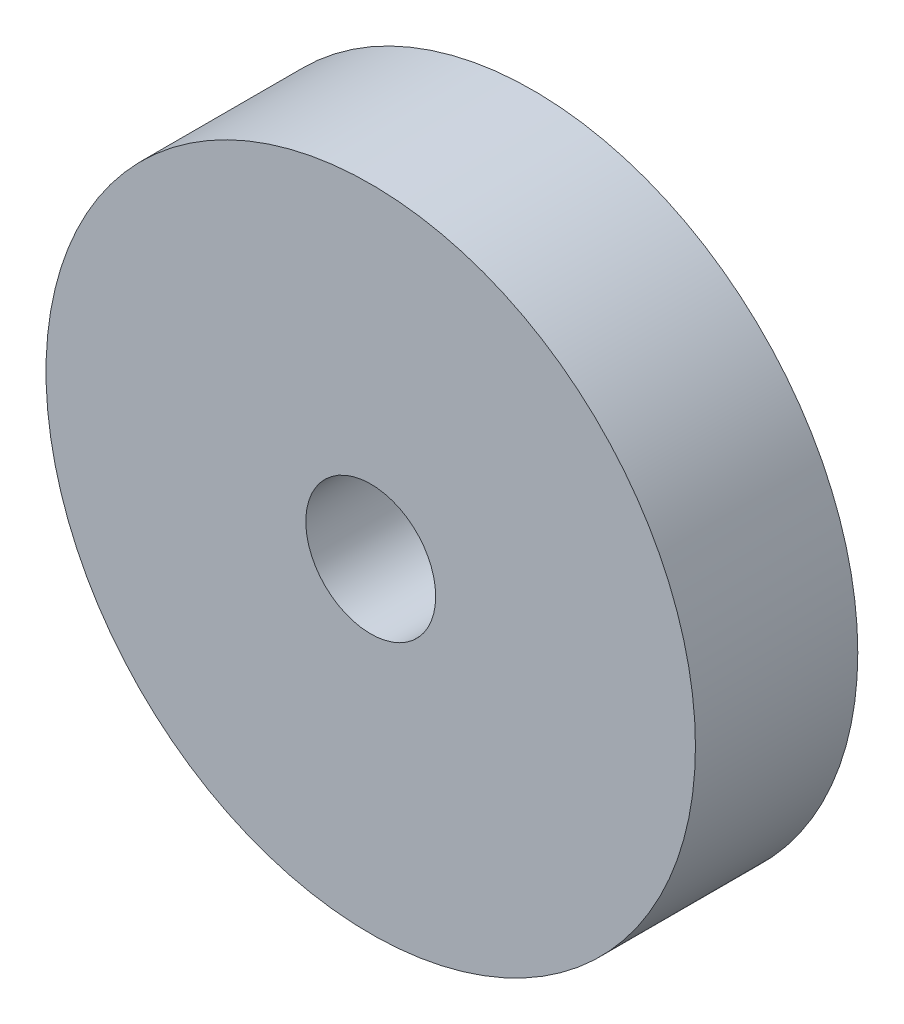
from build123d import *

# Parameters (mm, degrees)
ESQUISSE1_R             = 20
BOSS_EXTRU_1_DEPTH      = 10
ESQUISSE2_R             = 4
ENL_V_MAT_EXTRU_1_DEPTH = 301.83217913


with BuildPart() as part:
    # Esquisse1 → Boss.-Extru.1 (new body)
    with BuildSketch(Plane.XY):
        with Locations((0, 280)):
            Circle(ESQUISSE1_R)
    extrude(amount=BOSS_EXTRU_1_DEPTH)

    # Esquisse2 → Enlèv. mat.-Extru.1 (cut, through all)
    with BuildSketch(Plane.XY.offset(10)):
        with Locations((0, 280)):
            Circle(ESQUISSE2_R)
    extrude(amount=-ENL_V_MAT_EXTRU_1_DEPTH, mode=Mode.SUBTRACT)


solid = part.part
